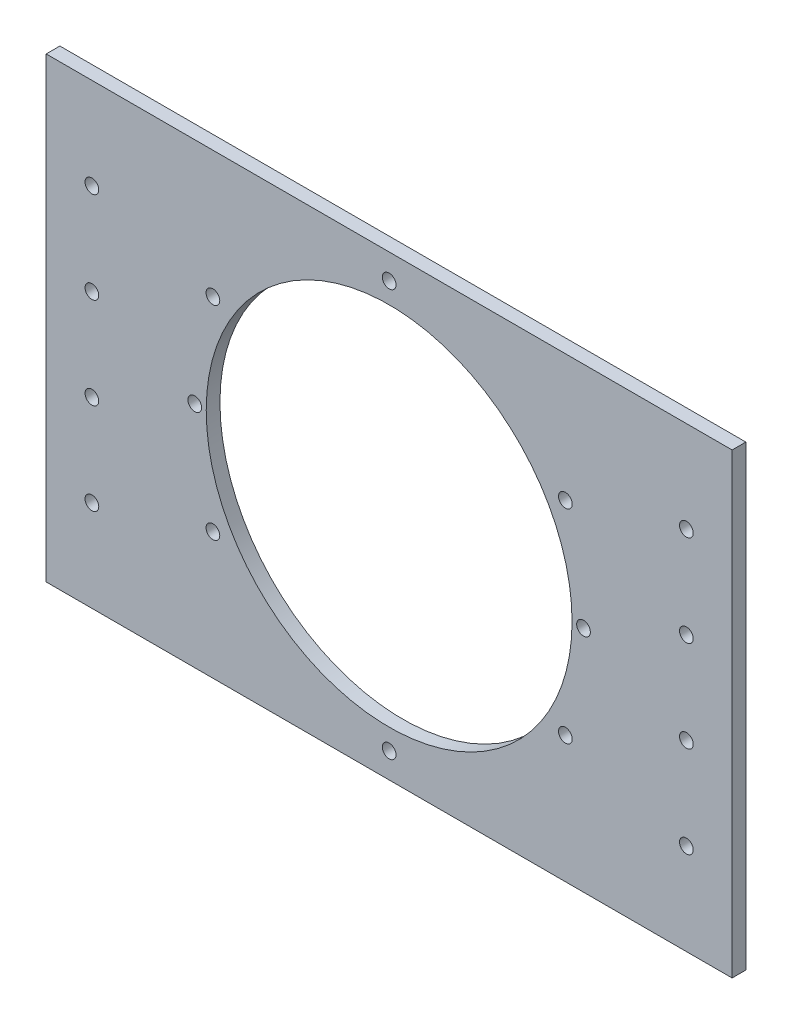
from build123d import *

# Parameters (mm, degrees)
SKETCH_1_W      = 150
SKETCH_1_H      = 100
SKETCH_1_R      = 1.5
SKETCH_1_R_2    = 40
EXTRUDE_2_DEPTH = 3


with BuildPart() as part:
    # 草图1 → 凸台-拉伸2 (new body)
    with BuildSketch(Plane.XY):
        Rectangle(SKETCH_1_W, SKETCH_1_H)
        with Locations((-38.538130468, 22.25)):
            Circle(SKETCH_1_R, mode=Mode.SUBTRACT)
        with Locations((-38.538130468, -22.25)):
            Circle(SKETCH_1_R, mode=Mode.SUBTRACT)
        with Locations((0, -44.5)):
            Circle(SKETCH_1_R, mode=Mode.SUBTRACT)
        with Locations((38.538130468, -22.25)):
            Circle(SKETCH_1_R, mode=Mode.SUBTRACT)
        with Locations((38.538130468, 22.25)):
            Circle(SKETCH_1_R, mode=Mode.SUBTRACT)
        with Locations((0, 44.5)):
            Circle(SKETCH_1_R, mode=Mode.SUBTRACT)
        with Locations((-42.5, 0)):
            Circle(SKETCH_1_R, mode=Mode.SUBTRACT)
        with Locations((42.5, 0)):
            Circle(SKETCH_1_R, mode=Mode.SUBTRACT)
        Circle(SKETCH_1_R_2, mode=Mode.SUBTRACT)
        with Locations((65, 10)):
            Circle(SKETCH_1_R, mode=Mode.SUBTRACT)
        with Locations((65, -30)):
            Circle(SKETCH_1_R, mode=Mode.SUBTRACT)
        with Locations((-65, -30)):
            Circle(SKETCH_1_R, mode=Mode.SUBTRACT)
        with Locations((-65, -10)):
            Circle(SKETCH_1_R, mode=Mode.SUBTRACT)
        with Locations((-65, 10)):
            Circle(SKETCH_1_R, mode=Mode.SUBTRACT)
        with Locations((-65, 30)):
            Circle(SKETCH_1_R, mode=Mode.SUBTRACT)
        with Locations((65, -10)):
            Circle(SKETCH_1_R, mode=Mode.SUBTRACT)
        with Locations((65, 30)):
            Circle(SKETCH_1_R, mode=Mode.SUBTRACT)
    extrude(amount=EXTRUDE_2_DEPTH)


solid = part.part
